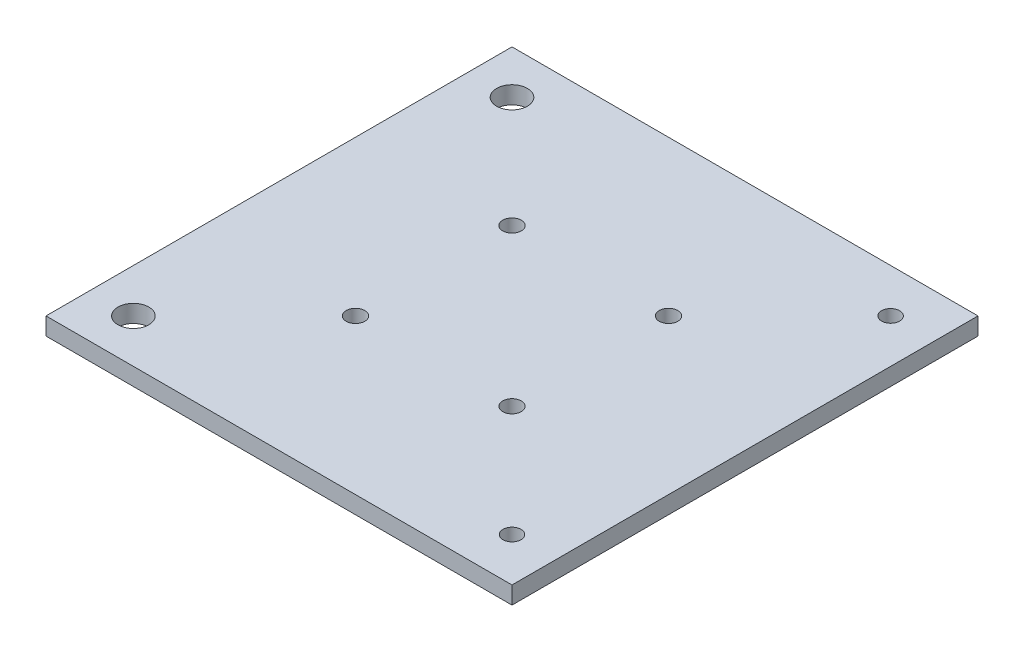
from build123d import *

# Parameters (mm, degrees)
SKETCH_1_W          = 80
SKETCH_1_H          = 80
SKETCH_1_R          = 2.65
SKETCH_1_R_2        = 1.55
EXTRUDE_1_DEPTH     = 4
SKETCH_2_R          = 1.6
CUT_EXTRUDE_1_DEPTH = 57.709787515
SKETCH_3_W          = 114.446601022
SKETCH_3_H          = 92.900037665
CUT_EXTRUDE_2_DEPTH = 1


with BuildPart() as part:
    # 草图1 → 凸台-拉伸1 (new body)
    with BuildSketch(Plane(origin=(0, 0, 0), x_dir=(1, 0, 0), z_dir=(0, 1, 0))):
        Rectangle(SKETCH_1_W, SKETCH_1_H)
        with Locations(Location((-32.5, 32.5, 0), (0, 0, 270))):
            Circle(SKETCH_1_R, mode=Mode.SUBTRACT)
        with Locations(Location((-32.5, -32.5, 0), (0, 0, 270))):
            Circle(SKETCH_1_R, mode=Mode.SUBTRACT)
        with Locations(Location((32.5, 32.5, 0), (0, 0, 270))):
            Circle(SKETCH_1_R_2, mode=Mode.SUBTRACT)
        with Locations(Location((32.5, -32.5, 0), (0, 0, 270))):
            Circle(SKETCH_1_R_2, mode=Mode.SUBTRACT)
    extrude(amount=EXTRUDE_1_DEPTH)

    # 草图2 → 切除-拉伸1 (cut, through all)
    with BuildSketch(Plane(origin=(0, 4, 0), x_dir=(1, 0, 0), z_dir=(0, 1, 0))):
        with Locations(Location((13.435028843, 13.435028843, 0), (0, 0, 270))):
            Circle(SKETCH_2_R)
        with Locations(Location((13.435028843, -13.435028843, 0), (0, 0, 270))):
            Circle(SKETCH_2_R)
        with Locations(Location((-13.435028843, -13.435028843, 0), (0, 0, 270))):
            Circle(SKETCH_2_R)
        with Locations(Location((-13.435028843, 13.435028843, 0), (0, 0, 270))):
            Circle(SKETCH_2_R)
    extrude(amount=-CUT_EXTRUDE_1_DEPTH, mode=Mode.SUBTRACT)

    # 草图3 → 切除-拉伸2 (cut)
    with BuildSketch(Plane.XZ):
        with Locations((9.368071025, -1.951681463)):
            Rectangle(SKETCH_3_W, SKETCH_3_H)
    extrude(amount=-CUT_EXTRUDE_2_DEPTH, mode=Mode.SUBTRACT)


solid = part.part
